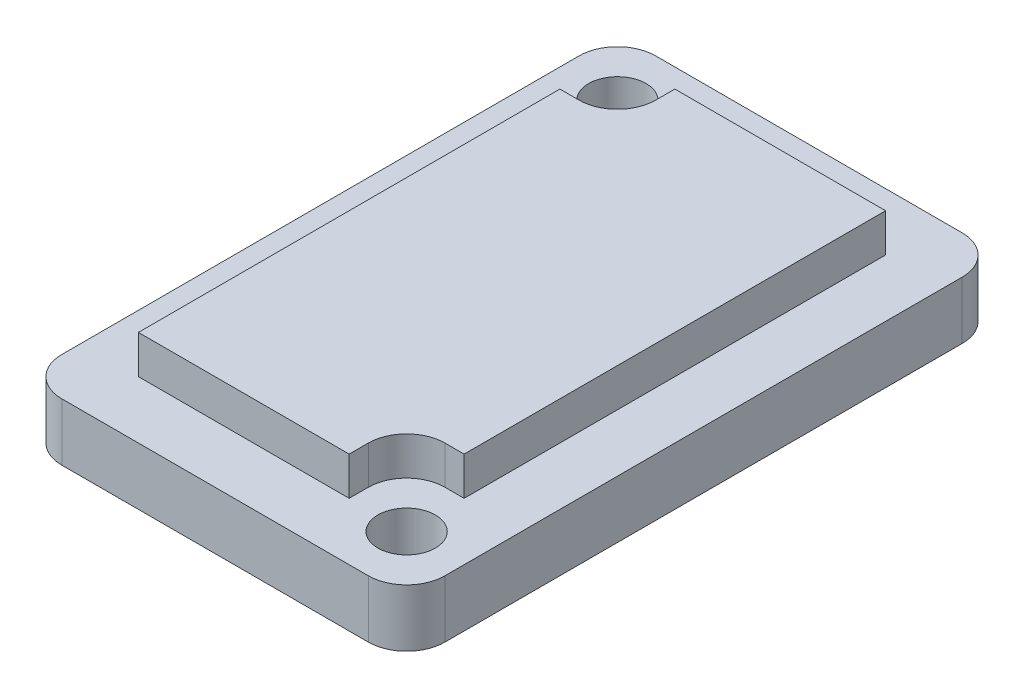
from build123d import *

# Parameters (mm, degrees)
CROQUIS1_W              = 20
CROQUIS1_H              = 31
SALIENTE_EXTRUIR1_DEPTH = 3
REDONDEO1_R             = 2
SALIENTE_EXTRUIR2_DEPTH = 2
CROQUIS3_R              = 1.5
CORTAR_EXTRUIR1_DEPTH   = 4


with BuildPart() as part:
    # Croquis1 → Saliente-Extruir1 (new body)
    with BuildSketch(Plane(origin=(0, 0, 0), x_dir=(1, 0, 0), z_dir=(0, 1, 0))):
        Rectangle(CROQUIS1_W, CROQUIS1_H)
    extrude(amount=SALIENTE_EXTRUIR1_DEPTH)

    # Redondeo1
    redondeo1_edges = [part.edges().sort_by_distance(p)[0] for p in [
        (10, 1.5, 15.5),
        (-10, 1.5, 15.5),
        (-10, 1.5, -15.5),
        (10, 1.5, -15.5),
    ]]
    fillet(redondeo1_edges, radius=REDONDEO1_R)

    # Croquis2 → Saliente-Extruir2 (add)
    with BuildSketch(Plane(origin=(0, 3, 0), x_dir=(1, 0, 0), z_dir=(0, 1, 0))):
        with BuildLine():
            Line((-7, -12.5), (4, -12.5))
            Line((4, -12.5), (4, -11.5))
            ThreePointArc((4, -11.5), (4.585786438, -10.085786438), (6, -9.5))
            Line((6, -9.5), (7, -9.5))
            Line((7, -9.5), (7, 12.5))
            Line((7, 12.5), (-4, 12.5))
            Line((-4, 12.5), (-4, 11.5))
            ThreePointArc((-4, 11.5), (-4.585786438, 10.085786438), (-6, 9.5))
            Line((-6, 9.5), (-7, 9.5))
            Line((-7, 9.5), (-7, -12.5))
        make_face()
    extrude(amount=SALIENTE_EXTRUIR2_DEPTH)

    # Croquis3 → Cortar-Extruir1 (cut)
    with BuildSketch(Plane(origin=(0, 3, 0), x_dir=(1, 0, 0), z_dir=(0, 1, 0))):
        with Locations(Location((-7, 12.5, 0), (0, 0, 270))):
            Circle(CROQUIS3_R)
        with Locations(Location((7, -12.5, 0), (0, 0, 270))):
            Circle(CROQUIS3_R)
    extrude(amount=-CORTAR_EXTRUIR1_DEPTH, mode=Mode.SUBTRACT)


solid = part.part
